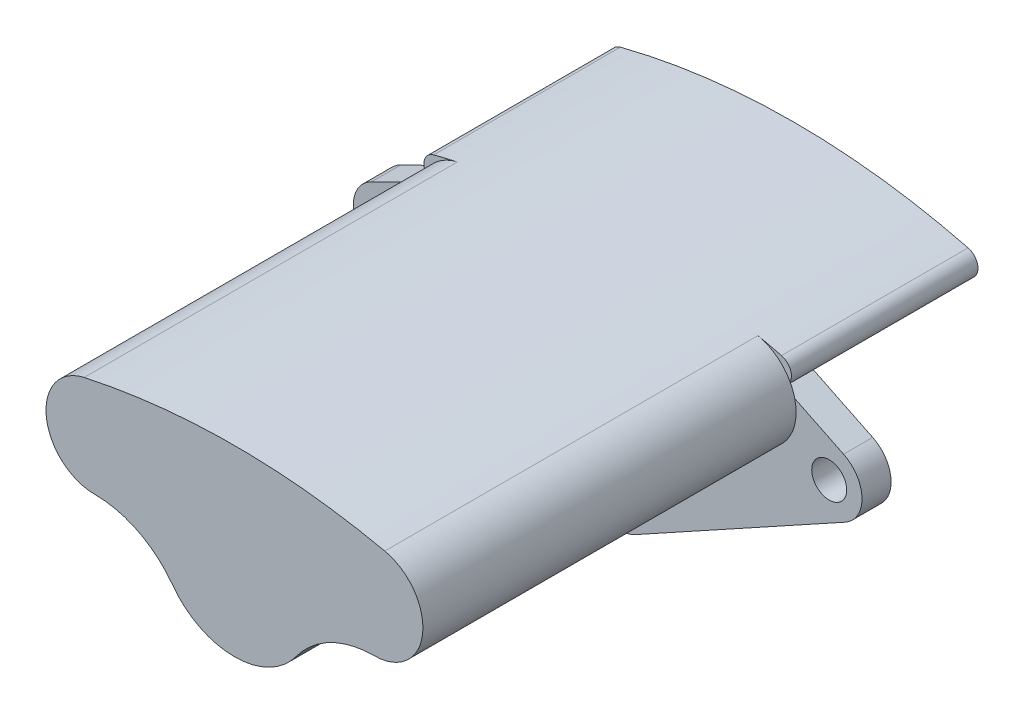
from build123d import *

# Parameters (mm, degrees)
BOSS_EXTRUDE1_DEPTH = 7.9248
SKETCH1_R           = 15.113
SKETCH1_R_2         = 4.7625
CUT_EXTRUDE1_DEPTH  = 80.272040778
BOSS_EXTRUDE2_DEPTH = 101.6
BOSS_EXTRUDE3_START = 50.8
BOSS_EXTRUDE3_DEPTH = 50.8


with BuildPart() as part:
    # Sketch3 → Boss-Extrude1 (new body)
    with BuildSketch(Plane.XY):
        with BuildLine():
            Line((-64.234613185, 11.323473258), (-41.773518083, 22.268986661))
            ThreePointArc((-41.773518083, 22.268986661), (-35.255720627, 22.619332528), (-30.461132459, 18.190297621))
            Line((-30.461132459, 18.190297621), (-18.440189358, -8.351633097))
            ThreePointArc((-18.440189358, -8.351633097), (0, -20.243279352), (18.440189358, -8.351633097))
            Line((18.440189358, -8.351633097), (30.461132459, 18.190297621))
            ThreePointArc((30.461132459, 18.190297621), (35.255720627, 22.619332528), (41.773518083, 22.268986661))
            Line((41.773518083, 22.268986661), (64.234613185, 11.323473258))
            ThreePointArc((64.234613185, 11.323473258), (69.246925134, 3.525173307), (64.633248189, -4.515394972))
            Line((64.633248189, -4.515394972), (8.109165467, -35.67188883))
            ThreePointArc((8.109165467, -35.67188883), (0, -37.758787862), (-8.109165467, -35.67188883))
            Line((-8.109165467, -35.67188883), (-64.633248189, -4.515394972))
            ThreePointArc((-64.633248189, -4.515394972), (-69.246925134, 3.525173307), (-64.234613185, 11.323473258))
        make_face()
    extrude(amount=BOSS_EXTRUDE1_DEPTH)

    # Sketch1 → Cut-Extrude1 (cut, through all)
    with BuildSketch(Plane.XY):
        Circle(SKETCH1_R)
        with Locations((-60.325, 3.300624961)):
            Circle(SKETCH1_R_2)
        with Locations((-38.1, 14.730624961)):
            Circle(SKETCH1_R_2)
        with Locations(Location((38.1, 14.730624961, 0), (0, 0, 180))):
            Circle(SKETCH1_R_2)
        with Locations(Location((60.325, 3.300624961, 0), (0, 0, 180))):
            Circle(SKETCH1_R_2)
    extrude(amount=CUT_EXTRUDE1_DEPTH, mode=Mode.SUBTRACT)

    # Sketch4 → Boss-Extrude2 (add)
    with BuildSketch(Plane.XY.offset(7.9248)):
        with BuildLine():
            ThreePointArc((-40.926635767, 27.63434288), (-20.582852086, 30.953683993), (0, 32.064431449))
            ThreePointArc((0, 32.064431449), (20.582852086, 30.953683993), (40.926635767, 27.63434288))
            ThreePointArc((40.926635767, 27.63434288), (51.23189196, 13.299115463), (38.080011359, 1.520954021))
            ThreePointArc((38.080011359, 1.520954021), (26.188891906, -1.306064402), (16.866232202, -9.210415804))
            ThreePointArc((16.866232202, -9.210415804), (9.454365502, -15.499494869), (0, -17.758533696))
            ThreePointArc((0, -17.758533696), (-9.454365502, -15.499494869), (-16.866232202, -9.210415804))
            ThreePointArc((-16.866232202, -9.210415804), (-26.188891906, -1.306064402), (-38.080011359, 1.520954021))
            ThreePointArc((-38.080011359, 1.520954021), (-51.23189196, 13.299115463), (-40.926635767, 27.63434288))
        make_face()
    extrude(amount=BOSS_EXTRUDE2_DEPTH)

    # Sketch5 → Boss-Extrude3 (add)
    with BuildSketch(Plane(origin=(0, 0, 7.9248), x_dir=(-1, 0, 0), z_dir=(0, 0, -1)).offset(BOSS_EXTRUDE3_START)):
        with BuildLine():
            ThreePointArc((-47.327995259, 26.116255836), (0, 32.064431449), (47.327995259, 26.116255836))
            ThreePointArc((47.327995259, 26.116255836), (49.920381816, 21.745535091), (45.549661071, 19.153148533))
            ThreePointArc((45.549661071, 19.153148533), (0, 24.877823363), (-45.549661071, 19.153148533))
            ThreePointArc((-45.549661071, 19.153148533), (-49.920381816, 21.745535091), (-47.327995259, 26.116255836))
        make_face()
    extrude(amount=-BOSS_EXTRUDE3_DEPTH)


solid = part.part
